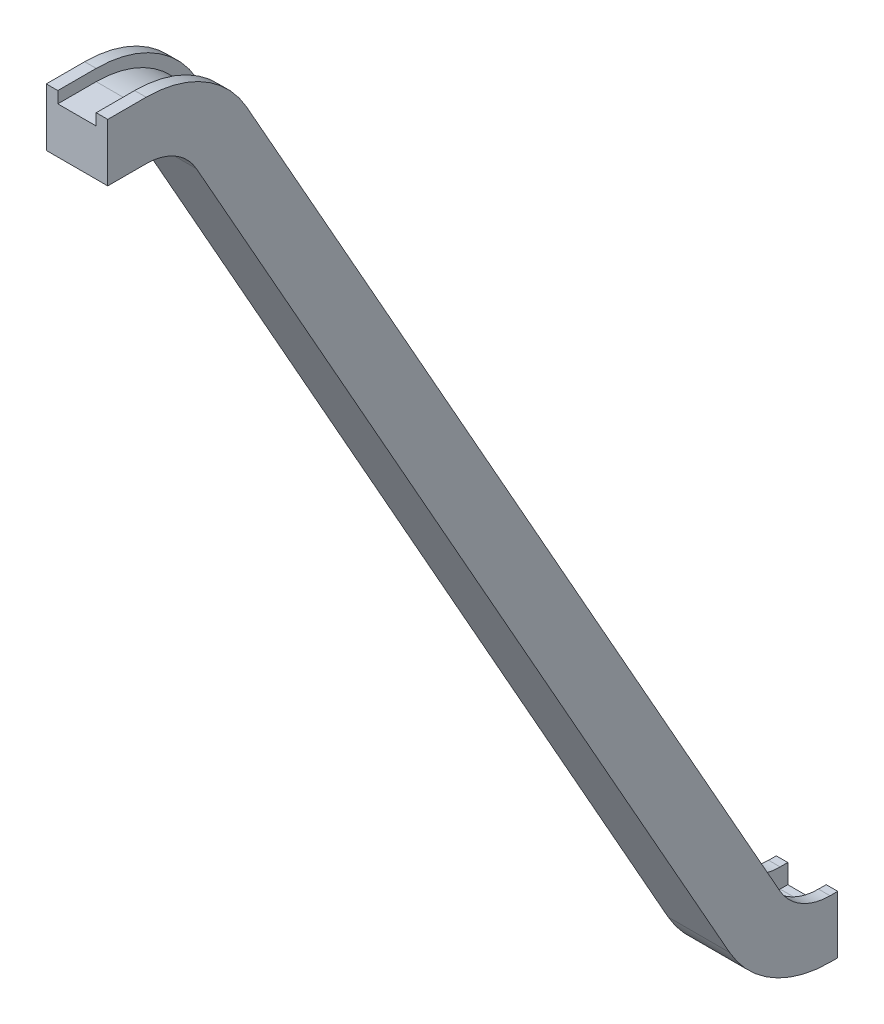
from build123d import *

# Parameters (mm, degrees)
BOSS_EXTRUDE1_DEPTH = 16
CUT_EXTRUDE1_START  = -13
CUT_EXTRUDE1_DEPTH  = 10


with BuildPart() as part:
    # Sketch1 → Boss-Extrude1 (new body)
    with BuildSketch(Plane(origin=(0, 0, 0), x_dir=(0, 0, -1), z_dir=(1, 0, 0))):
        with BuildLine():
            Line((0, 0), (10, 0))
            ThreePointArc((10, 0), (17.565310247, -2.047545373), (23.065245029, -7.631189218))
            Line((23.065245029, -7.631189218), (161.869509942, -253.737621564))
            ThreePointArc((161.869509942, -253.737621564), (172.869379506, -264.904909254), (188, -269))
            Line((188, -269), (190, -269))
            Line((190, -269), (190, -254))
            Line((190, -254), (188, -254))
            ThreePointArc((188, -254), (180.434689753, -251.952454627), (174.934754971, -246.368810782))
            Line((174.934754971, -246.368810782), (36.130490058, -0.262378436))
            ThreePointArc((36.130490058, -0.262378436), (25.130620494, 10.904909254), (10, 15))
            Line((10, 15), (0, 15))
            Line((0, 15), (0, 0))
        make_face()
    extrude(amount=BOSS_EXTRUDE1_DEPTH)

    # Sketch3 → Cut-Extrude1 (cut)
    with BuildSketch(Plane(origin=(16, 0, 0), x_dir=(0, 0, -1), z_dir=(1, 0, 0)).offset(CUT_EXTRUDE1_START)):
        with BuildLine():
            Line((10, 15), (0, 15))
            Line((0, 15), (0, 12))
            Line((0, 12), (10, 12))
            ThreePointArc((10, 12), (23.700034196, 8.26604958), (33.610790729, -1.903032367))
            Line((33.610790729, -1.903032367), (170.510525386, -248.701457506))
            ThreePointArc((170.510525386, -248.701457506), (177.851826522, -256.2341108), (188, -259))
            Line((188, -259), (190, -259))
            Line((190, -259), (190, -254))
            Line((190, -254), (188, -254))
            ThreePointArc((188, -254), (180.434689753, -251.952454627), (174.934754971, -246.368810782))
            Line((174.934754971, -246.368810782), (36.130490058, -0.262378436))
            ThreePointArc((36.130490058, -0.262378436), (25.130620494, 10.904909254), (10, 15))
        make_face()
    extrude(amount=CUT_EXTRUDE1_DEPTH, mode=Mode.SUBTRACT)


solid = part.part
